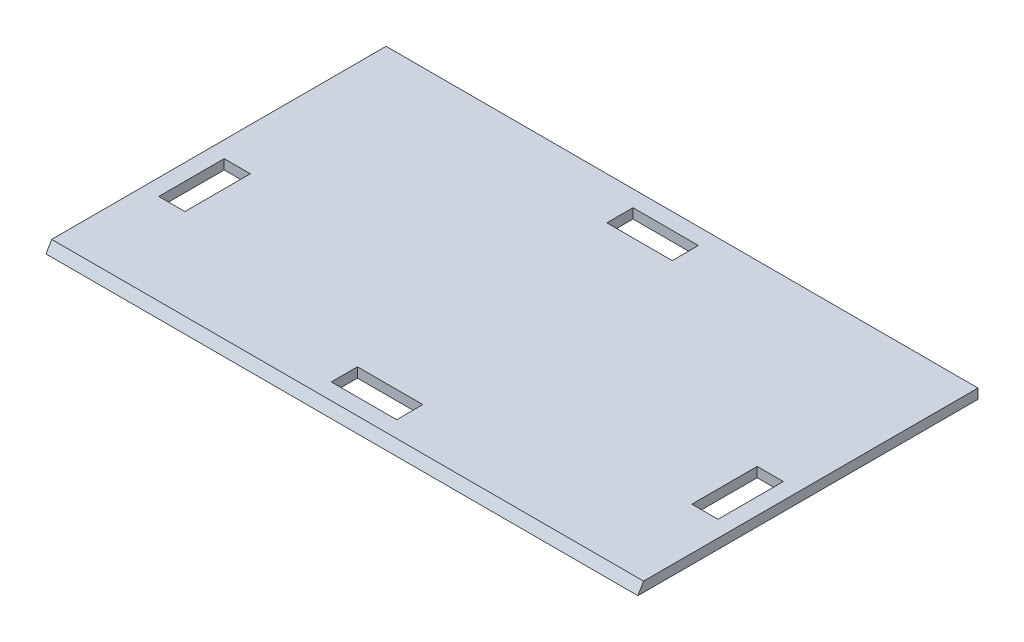
from build123d import *

# Parameters (mm, degrees)
BOSS_EXTRUDE1_DEPTH = 181
SKETCH2_W           = 20
SKETCH2_H           = 8
SKETCH2_W_2         = 8
SKETCH2_H_2         = 20
CUT_EXTRUDE1_DEPTH  = 4
SKETCH3_W           = 11.684269825
SKETCH3_H           = 21.954659585
BOSS_EXTRUDE2_DEPTH = 3


with BuildPart() as part:
    # Sketch1 → Boss-Extrude1 (new body)
    with BuildSketch(Plane(origin=(0, 0, 0), x_dir=(0, 0, -1), z_dir=(1, 0, 0))):
        Polygon((0.351294643, 16.181618247), (2.08334545, 19.181618247), (104.351294643, 19.181618247), (104.351294643, 16.181618247), align=None)
    extrude(amount=-BOSS_EXTRUDE1_DEPTH)

    # Sketch2 → Cut-Extrude1 (cut)
    with BuildSketch(Plane(origin=(0, 19.181618247, 0), x_dir=(1, 0, 0), z_dir=(0, 1, 0))):
        with Locations((-90.499224225, 95.351294643)):
            Rectangle(SKETCH2_W, SKETCH2_H)
        with Locations((-8.999224225, 39.831548681)):
            Rectangle(SKETCH2_W_2, SKETCH2_H_2)
    cut_extrude1 = extrude(amount=-CUT_EXTRUDE1_DEPTH, mode=Mode.SUBTRACT)

    # Mirror1: Cut-Extrude1 across plane
    add(cut_extrude1.mirror(Plane.ZY.offset(90.499224225)), mode=Mode.SUBTRACT)

    # Mirror2: Cut-Extrude1 across plane
    add(cut_extrude1.mirror(Plane(origin=(0, 0, -53.216294643), x_dir=(1, 0, 0), z_dir=(0, 0, -1))), mode=Mode.SUBTRACT)

    # Sketch3 → Boss-Extrude2 (add)
    with BuildSketch(Plane(origin=(0, 19.181618247, 0), x_dir=(1, 0, 0), z_dir=(0, 1, 0))):
        with Locations((-10.841359137, 66.584328743)):
            Rectangle(SKETCH3_W, SKETCH3_H)
    extrude(amount=-BOSS_EXTRUDE2_DEPTH)


solid = part.part
